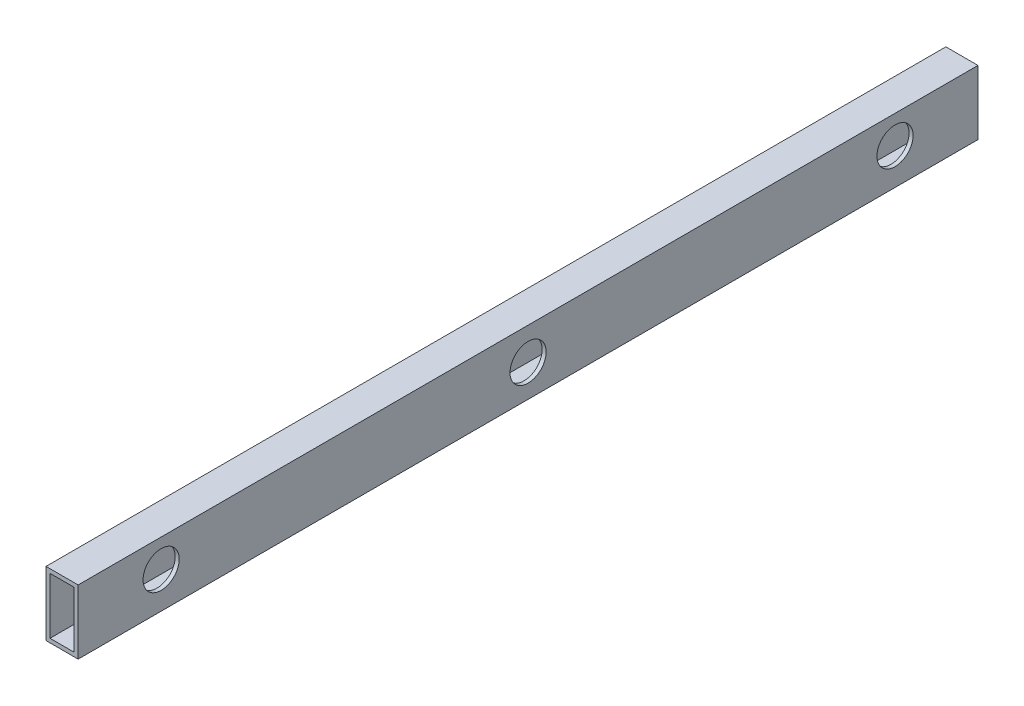
from build123d import *

# Parameters (mm, degrees)
BOSS_EXTRUDE1_DEPTH      = 355.6
BOSS_EXTRUDE1_DEPTH_BACK = 355.6
SKETCH1_W                = 25.4
SKETCH1_H                = 50.8
SKETCH1_W_2              = 19.05
SKETCH1_H_2              = 44.45
SKETCH2_R                = 14.2875
CUT_EXTRUDE1_DEPTH       = 461.889281715


with BuildPart() as part:
    # Sketch1 → Boss-Extrude1 (new, two sides: drawn at the far end of the back side and taken through both)
    with BuildSketch(Plane.XY.offset(-BOSS_EXTRUDE1_DEPTH_BACK)):
        with Locations((279.4, 0)):
            Rectangle(SKETCH1_W, SKETCH1_H)
        with Locations((279.4, 0)):
            Rectangle(SKETCH1_W_2, SKETCH1_H_2, mode=Mode.SUBTRACT)
    extrude(amount=BOSS_EXTRUDE1_DEPTH + BOSS_EXTRUDE1_DEPTH_BACK)

    # Sketch2 → Cut-Extrude1 (cut, through all)
    with BuildSketch(Plane(origin=(0, 0, 0), x_dir=(0, 0, -1), z_dir=(1, 0, 0))):
        with Locations((290.007440579, 3.175)):
            Circle(SKETCH2_R)
        Circle(SKETCH2_R)
        with Locations((-290.007440579, 3.175)):
            Circle(SKETCH2_R)
    extrude(amount=CUT_EXTRUDE1_DEPTH, mode=Mode.SUBTRACT)


solid = part.part
